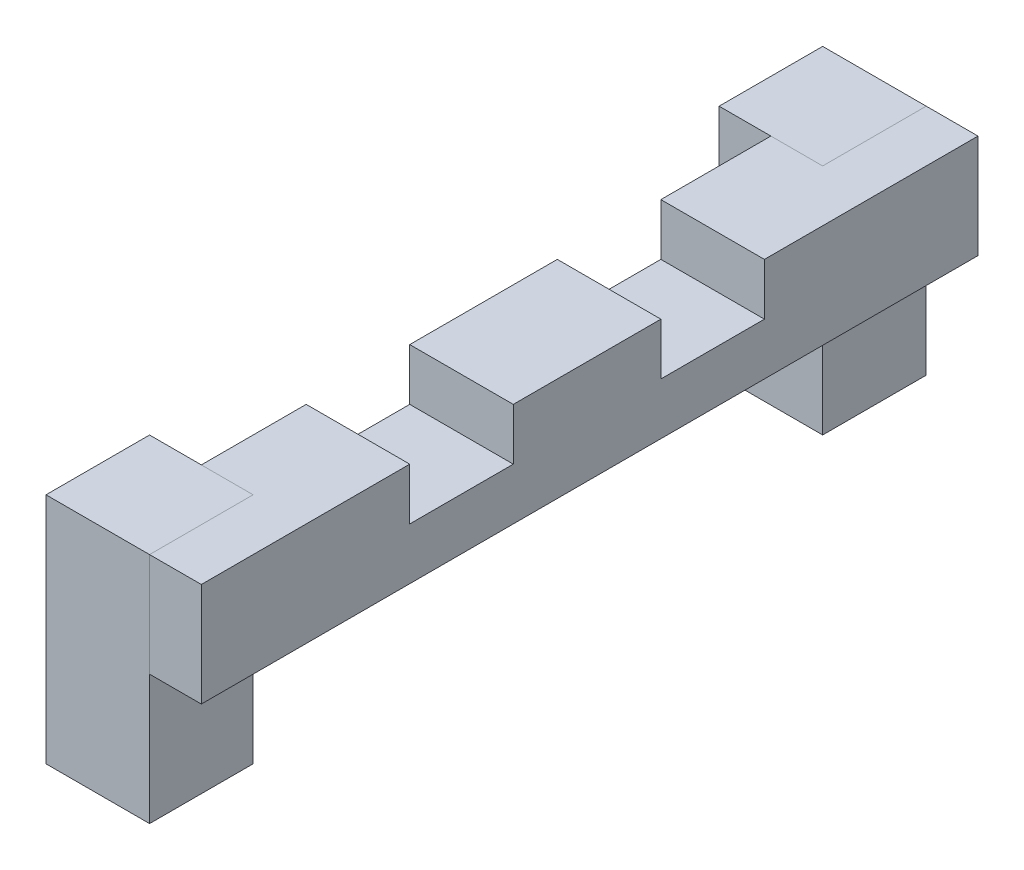
from build123d import *

# Parameters (mm, degrees)
SKETCH1_W           = 40
SKETCH1_H           = 300
BOSS_EXTRUDE1_DEPTH = 40
SKETCH2_W           = 40
SKETCH2_H           = 40
CUT_EXTRUDE1_DEPTH  = 20
SKETCH7_W           = 20
SKETCH7_H           = 40
CUT_EXTRUDE4_DEPTH  = 40
SKETCH3_W           = 40
SKETCH3_H           = 90
BOSS_EXTRUDE2_DEPTH = 40
SKETCH6_W           = 20
SKETCH6_H           = 40
CUT_EXTRUDE3_DEPTH  = 40
SKETCH4_W           = 40
SKETCH4_H           = 90
BOSS_EXTRUDE3_DEPTH = 40


with BuildPart() as part:
    # Sketch1 → Boss-Extrude1 (new body)
    with BuildSketch(Plane(origin=(0, 0, 0), x_dir=(1, 0, 0), z_dir=(0, 1, 0))):
        with Locations((20, -150)):
            Rectangle(SKETCH1_W, SKETCH1_H)
    extrude(amount=BOSS_EXTRUDE1_DEPTH)

    # Sketch2 → Cut-Extrude1 (cut)
    with BuildSketch(Plane(origin=(0, 40, 0), x_dir=(1, 0, 0), z_dir=(0, 1, 0))):
        with Locations((20, -102.5)):
            Rectangle(SKETCH2_W, SKETCH2_H)
        with Locations((20, -199.5)):
            Rectangle(SKETCH2_W, SKETCH2_H)
    extrude(amount=-CUT_EXTRUDE1_DEPTH, mode=Mode.SUBTRACT)

    # Sketch7 → Cut-Extrude4 (cut)
    with BuildSketch(Plane.XY.offset(300)):
        with Locations((10, 20)):
            Rectangle(SKETCH7_W, SKETCH7_H)
    extrude(amount=-CUT_EXTRUDE4_DEPTH, mode=Mode.SUBTRACT)

    # Sketch6 → Cut-Extrude3 (cut)
    with BuildSketch(Plane(origin=(0, 0, 0), x_dir=(-1, 0, 0), z_dir=(0, 0, -1))):
        with Locations((-10, 20)):
            Rectangle(SKETCH6_W, SKETCH6_H)
    extrude(amount=-CUT_EXTRUDE3_DEPTH, mode=Mode.SUBTRACT)


with BuildPart() as body_2:
    # Sketch3 → Boss-Extrude2 (new body)
    with BuildSketch(Plane.XY.offset(300)):
        with Locations((0, -5)):
            Rectangle(SKETCH3_W, SKETCH3_H)
    extrude(amount=-BOSS_EXTRUDE2_DEPTH)


with BuildPart() as body_3:
    # Sketch4 → Boss-Extrude3 (new body)
    with BuildSketch(Plane(origin=(0, 0, 0), x_dir=(-1, 0, 0), z_dir=(0, 0, -1))):
        with Locations((0, -5)):
            Rectangle(SKETCH4_W, SKETCH4_H)
    extrude(amount=-BOSS_EXTRUDE3_DEPTH)


solid = Compound([part.part, body_2.part, body_3.part])
